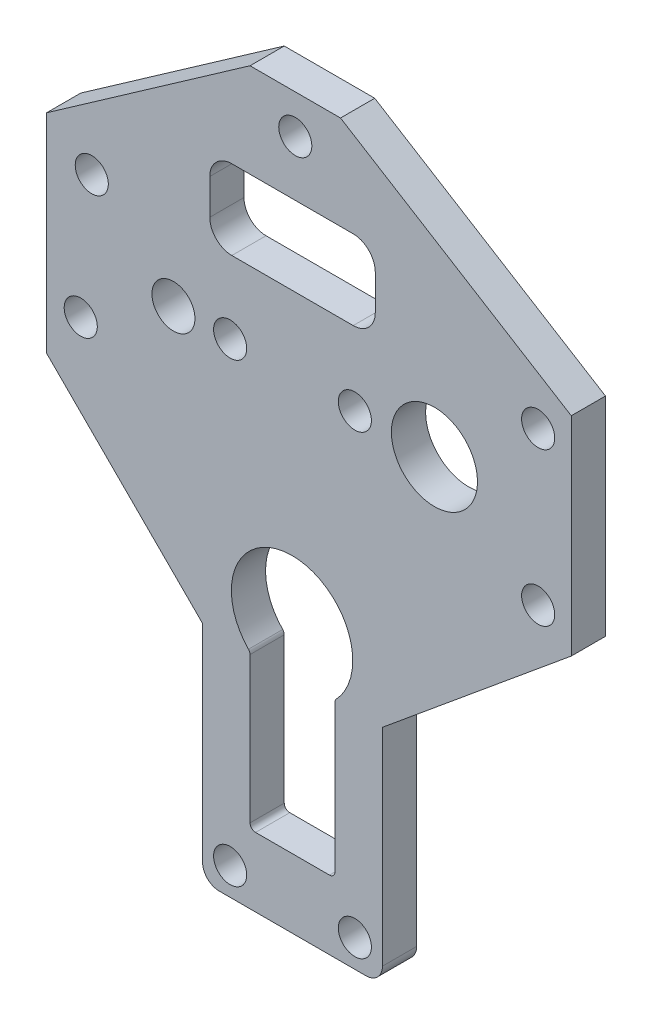
from build123d import *

# Parameters (mm, degrees)
SKETCH1_R           = 1.5
SKETCH1_R_2         = 1.95
SKETCH1_R_3         = 3.9
BOSS_EXTRUDE1_DEPTH = 3.1


with BuildPart() as part:
    # Sketch1 → Boss-Extrude1 (new body)
    with BuildSketch(Plane.XY):
        with BuildLine():
            Line((0, 0), (0, 18.861213353))
            Line((0, 18.861213353), (18.442135624, 31.774535738))
            Line((18.442135624, 31.774535738), (26.642135624, 31.774535738))
            Line((26.642135624, 31.774535738), (47.552083318, 18.861213353))
            Line((47.552083318, 18.861213353), (47.552083318, 0))
            Line((47.552083318, 0), (30.440578527, -14.143422634))
            Line((30.440578527, -14.143422634), (30.440578527, -32.892135624))
            ThreePointArc((30.440578527, -32.892135624), (30.001238699, -33.952795796), (28.940578527, -34.392135624))
            Line((28.940578527, -34.392135624), (15.642135624, -34.392135624))
            ThreePointArc((15.642135624, -34.392135624), (14.581475452, -33.952795796), (14.142135624, -32.892135624))
            Line((14.142135624, -32.892135624), (14.142135624, -14.142135624))
            Line((14.142135624, -14.142135624), (0, 0))
        make_face()
        with Locations(Location((4.1, 16.058642392, 0), (0, 0, 180))):
            Circle(SKETCH1_R, mode=Mode.SUBTRACT)
        with Locations(Location((3.1, 4.378644873, 0), (0, 0, 180))):
            Circle(SKETCH1_R, mode=Mode.SUBTRACT)
        with Locations(Location((11.5, 9.430606677, 0), (0, 0, 180))):
            Circle(SKETCH1_R_2, mode=Mode.SUBTRACT)
        with Locations(Location((35.152083318, 9.430606677, 0), (0, 0, 180))):
            Circle(SKETCH1_R_3, mode=Mode.SUBTRACT)
        with Locations(Location((16.642135624, -31.892135624, 0), (0, 0, 180))):
            Circle(SKETCH1_R, mode=Mode.SUBTRACT)
        with Locations(Location((27.940578527, -31.892135624, 0), (0, 0, 180))):
            Circle(SKETCH1_R, mode=Mode.SUBTRACT)
        with Locations(Location((16.642135624, 9.430606677, 0), (0, 0, 180))):
            Circle(SKETCH1_R, mode=Mode.SUBTRACT)
        with Locations(Location((27.940578527, 9.430606677, 0), (0, 0, 180))):
            Circle(SKETCH1_R, mode=Mode.SUBTRACT)
        with Locations(Location((22.542135624, 28.274535738, 0), (0, 0, 180))):
            Circle(SKETCH1_R, mode=Mode.SUBTRACT)
        with Locations(Location((44.552083318, 2.5, 0), (0, 0, 180))):
            Circle(SKETCH1_R, mode=Mode.SUBTRACT)
        with Locations(Location((44.552083318, 16.361213353, 0), (0, 0, 180))):
            Circle(SKETCH1_R, mode=Mode.SUBTRACT)
        with BuildLine():
            Line((18.442135624, -14.432395526), (18.442135624, -27.642135624))
            ThreePointArc((18.442135624, -27.642135624), (18.588582233, -27.995689014), (18.942135624, -28.142135624))
            Line((18.942135624, -28.142135624), (25.640578527, -28.142135624))
            ThreePointArc((25.640578527, -28.142135624), (25.994131918, -27.995689014), (26.140578527, -27.642135624))
            Line((26.140578527, -27.642135624), (26.140578527, -14.345175543))
            ThreePointArc((26.140578527, -14.345175543), (26.175312874, -14.162069365), (26.274690017, -14.004403481))
            ThreePointArc((26.274690017, -14.004403481), (22.194770242, -4.756187266), (18.301117356, -14.084355132))
            ThreePointArc((18.301117356, -14.084355132), (18.405541961, -14.24463353), (18.442135624, -14.432395526))
        make_face(mode=Mode.SUBTRACT)
        with BuildLine():
            Line((16.792135624, 16.058642392), (27.790578527, 16.058642392))
            ThreePointArc((27.790578527, 16.058642392), (29.204792089, 16.64442883), (29.790578527, 18.058642392))
            Line((29.790578527, 18.058642392), (29.790578527, 21.258642392))
            ThreePointArc((29.790578527, 21.258642392), (29.204792089, 22.672855954), (27.790578527, 23.258642392))
            Line((27.790578527, 23.258642392), (16.792135624, 23.258642392))
            ThreePointArc((16.792135624, 23.258642392), (15.377922061, 22.672855954), (14.792135624, 21.258642392))
            Line((14.792135624, 21.258642392), (14.792135624, 18.058642392))
            ThreePointArc((14.792135624, 18.058642392), (15.377922061, 16.64442883), (16.792135624, 16.058642392))
        make_face(mode=Mode.SUBTRACT)
    extrude(amount=BOSS_EXTRUDE1_DEPTH)


solid = part.part
